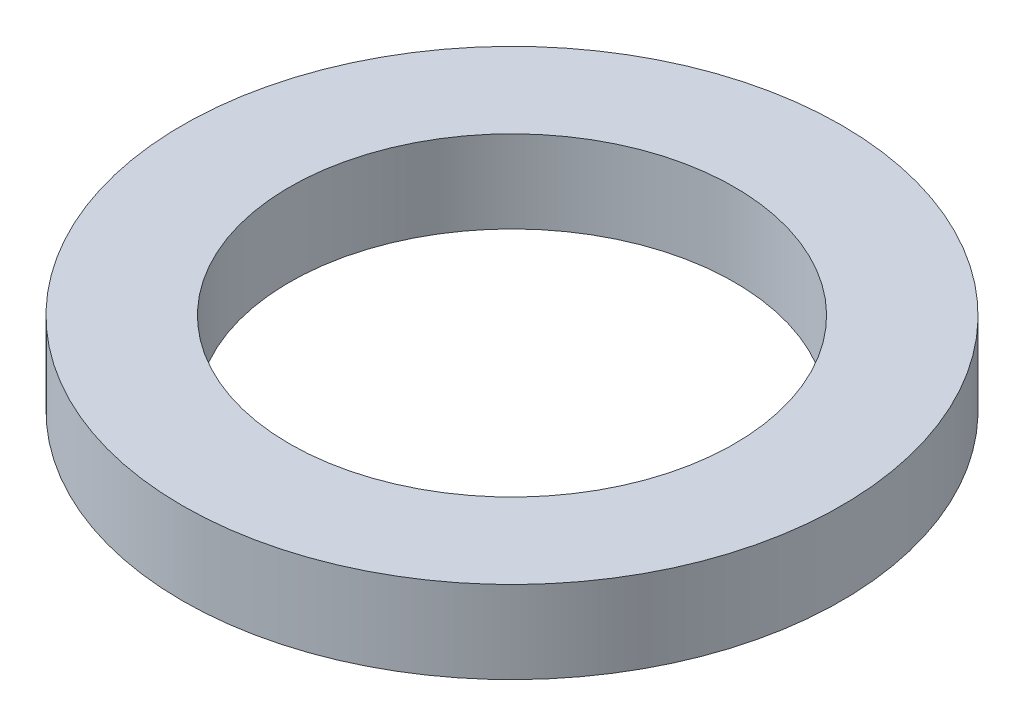
from build123d import *

# Parameters (mm, degrees)
SKETCH1_R           = 4
SKETCH1_R_2         = 2.7
BOSS_EXTRUDE1_DEPTH = 1


with BuildPart() as part:
    # Sketch1 → Boss-Extrude1 (new body)
    with BuildSketch(Plane(origin=(0, 0, 0), x_dir=(1, 0, 0), z_dir=(0, 1, 0))):
        with Locations(Location((0, 0, 0), (0, 0, 270))):
            Circle(SKETCH1_R)
        with Locations(Location((0, 0, 0), (0, 0, 270))):
            Circle(SKETCH1_R_2, mode=Mode.SUBTRACT)
    extrude(amount=BOSS_EXTRUDE1_DEPTH)


solid = part.part
